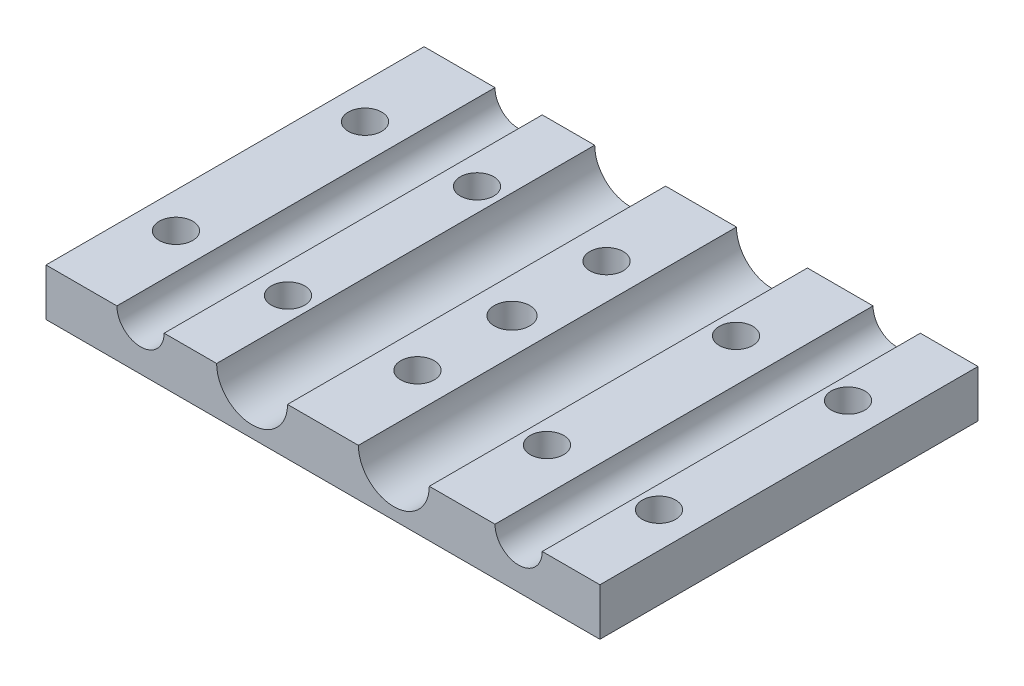
from build123d import *

# Parameters (mm, degrees)
SKETCH1_W             = 74.422
SKETCH1_H             = 50.8
BOSS_EXTRUDE1_DEPTH   = 6.35
SKETCH2_R             = 3.175
CUT_EXTRUDE1_DEPTH    = 64.289975675
SKETCH3_R             = 4.7625
CUT_EXTRUDE2_DEPTH    = 64.289975675
F_8_CLEARANCE_HOLE1_D = 4.4958
CUT_EXTRUDE3_DEPTH    = 3.175
SKETCH7_R             = 2.38125
CUT_EXTRUDE4_DEPTH    = 46.498802413
SKETCH8_R             = 0.8509
CUT_EXTRUDE5_DEPTH    = 9.525
BODY_MOVE_COPY1_ANGLE = 180


with BuildPart() as part:
    # Sketch1 → Boss-Extrude1 (new body)
    with BuildSketch(Plane(origin=(0, 0, 0), x_dir=(1, 0, 0), z_dir=(0, 1, 0))):
        Rectangle(SKETCH1_W, SKETCH1_H)
    extrude(amount=BOSS_EXTRUDE1_DEPTH)

    # Sketch2 → Cut-Extrude1 (cut, through all)
    with BuildSketch(Plane.XY.offset(25.4)):
        with Locations((-24.511, 0)):
            Circle(SKETCH2_R)
        with Locations((26.289, 0)):
            Circle(SKETCH2_R)
    extrude(amount=-CUT_EXTRUDE1_DEPTH, mode=Mode.SUBTRACT)

    # Sketch3 → Cut-Extrude2 (cut, through all)
    with BuildSketch(Plane.XY.offset(25.4)):
        with Locations((-9.525, 0)):
            Circle(SKETCH3_R)
        with Locations((9.525, 0)):
            Circle(SKETCH3_R)
    extrude(amount=-CUT_EXTRUDE2_DEPTH, mode=Mode.SUBTRACT)

    # #8 Clearance Hole1 (through all)
    with Locations(Plane(origin=(0, 6.35, 0), x_dir=(1, 0, 0), z_dir=(0, 1, 0))):
        with Locations((-32.4485, 12.7), (-32.4485, -12.7), (-17.399, -12.7), (0, -12.7), (17.399, -12.7), (32.4485, -12.7), (32.4485, 12.7), (17.399, 12.7), (0, 12.7), (-17.399, 12.7)):
            Hole(F_8_CLEARANCE_HOLE1_D / 2)

    # Sketch6 → Cut-Extrude3 (cut)
    with BuildSketch(Plane(origin=(0, 6.35, 0), x_dir=(1, 0, 0), z_dir=(0, 1, 0))):
        with BuildLine():
            Line((-13.081, 17.018), (-13.081, 8.382))
            ThreePointArc((-13.081, 8.382), (-17.399, 4.064), (-21.717, 8.382))
            Line((-21.717, 8.382), (-21.717, 17.018))
            ThreePointArc((-21.717, 17.018), (-17.399, 21.336), (-13.081, 17.018))
        make_face()
        with BuildLine():
            Line((13.081, 17.018), (13.081, 8.382))
            ThreePointArc((13.081, 8.382), (17.399, 4.064), (21.717, 8.382))
            Line((21.717, 8.382), (21.717, 17.018))
            ThreePointArc((21.717, 17.018), (17.399, 21.336), (13.081, 17.018))
        make_face()
        with BuildLine():
            Line((13.081, -17.018), (13.081, -8.382))
            ThreePointArc((13.081, -8.382), (17.399, -4.064), (21.717, -8.382))
            Line((21.717, -8.382), (21.717, -17.018))
            ThreePointArc((21.717, -17.018), (17.399, -21.336), (13.081, -17.018))
        make_face()
        with BuildLine():
            Line((-13.081, -17.018), (-13.081, -8.382))
            ThreePointArc((-13.081, -8.382), (-17.399, -4.064), (-21.717, -8.382))
            Line((-21.717, -8.382), (-21.717, -17.018))
            ThreePointArc((-21.717, -17.018), (-17.399, -21.336), (-13.081, -17.018))
        make_face()
        with BuildLine():
            Line((4.318, 17.018), (4.318, 8.382))
            ThreePointArc((4.318, 8.382), (0, 4.064), (-4.318, 8.382))
            Line((-4.318, 8.382), (-4.318, 17.018))
            ThreePointArc((-4.318, 17.018), (0, 21.336), (4.318, 17.018))
        make_face()
        with BuildLine():
            Line((4.318, -17.018), (4.318, -8.382))
            ThreePointArc((4.318, -8.382), (0, -4.064), (-4.318, -8.382))
            Line((-4.318, -8.382), (-4.318, -17.018))
            ThreePointArc((-4.318, -17.018), (0, -21.336), (4.318, -17.018))
        make_face()
        with BuildLine():
            Line((-28.1305, 17.018), (-28.1305, 8.382))
            ThreePointArc((-28.1305, 8.382), (-32.4485, 4.064), (-36.7665, 8.382))
            Line((-36.7665, 8.382), (-36.7665, 17.018))
            ThreePointArc((-36.7665, 17.018), (-32.4485, 21.336), (-28.1305, 17.018))
        make_face()
        with BuildLine():
            Line((-28.1305, -17.018), (-28.1305, -8.382))
            ThreePointArc((-28.1305, -8.382), (-32.4485, -4.064), (-36.7665, -8.382))
            Line((-36.7665, -8.382), (-36.7665, -17.018))
            ThreePointArc((-36.7665, -17.018), (-32.4485, -21.336), (-28.1305, -17.018))
        make_face()
        with BuildLine():
            Line((28.1305, 17.018), (28.1305, 8.382))
            ThreePointArc((28.1305, 8.382), (32.4485, 4.064), (36.7665, 8.382))
            Line((36.7665, 8.382), (36.7665, 17.018))
            ThreePointArc((36.7665, 17.018), (32.4485, 21.336), (28.1305, 17.018))
        make_face()
        with BuildLine():
            Line((28.1305, -17.018), (28.1305, -8.382))
            ThreePointArc((28.1305, -8.382), (32.4485, -4.064), (36.7665, -8.382))
            Line((36.7665, -8.382), (36.7665, -17.018))
            ThreePointArc((36.7665, -17.018), (32.4485, -21.336), (28.1305, -17.018))
        make_face()
    extrude(amount=-CUT_EXTRUDE3_DEPTH, mode=Mode.SUBTRACT)

    # Sketch7 → Cut-Extrude4 (cut, through all)
    with BuildSketch(Plane(origin=(0, 6.35, 0), x_dir=(1, 0, 0), z_dir=(0, 1, 0))):
        with Locations(Location((0, 0, 0), (0, 0, 270))):
            Circle(SKETCH7_R)
    extrude(amount=-CUT_EXTRUDE4_DEPTH, mode=Mode.SUBTRACT)

    # Sketch8 → Cut-Extrude5 (cut)
    with BuildSketch(Plane.XY.offset(25.4)):
        with Locations((0, 1.5875)):
            Circle(SKETCH8_R)
    extrude(amount=-CUT_EXTRUDE5_DEPTH, mode=Mode.SUBTRACT)


with BuildPart() as part_1:
    # Body-Move/Copy1: moved
    add(part.part.rotate(Axis((0, 3.175, 0), (1, 0, 0)), BODY_MOVE_COPY1_ANGLE))


solid = part_1.part
